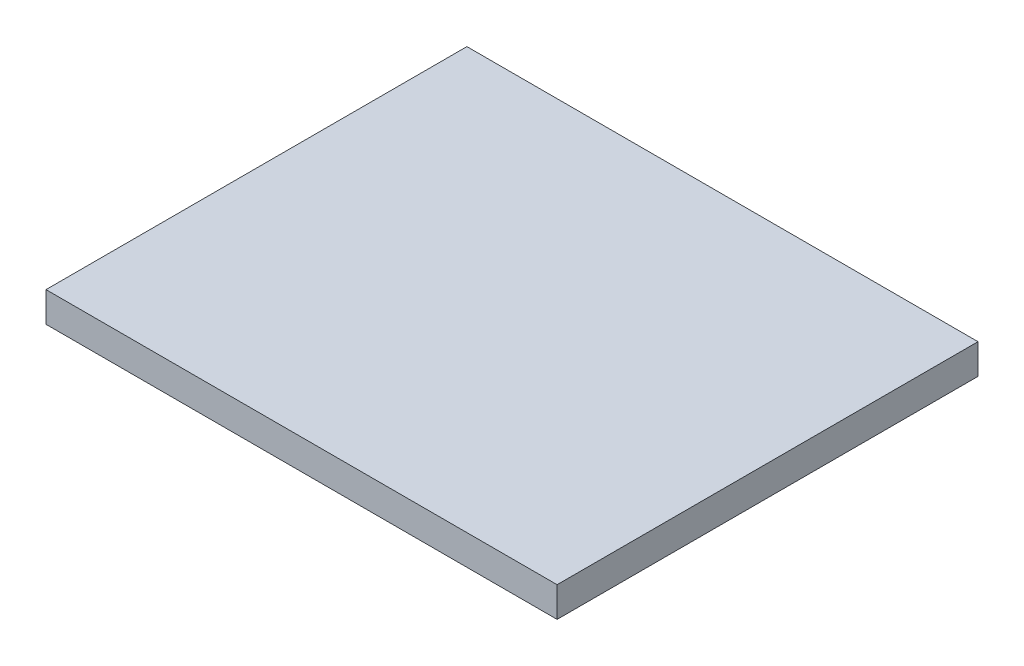
from build123d import *

# Parameters (mm, degrees)
SKETCH1_W           = 170
SKETCH1_H           = 140
BOSS_EXTRUDE1_DEPTH = 10


with BuildPart() as part:
    # Sketch1 → Boss-Extrude1 (new body)
    with BuildSketch(Plane(origin=(0, 0, 0), x_dir=(1, 0, 0), z_dir=(0, 1, 0))):
        Rectangle(SKETCH1_W, SKETCH1_H)
    extrude(amount=BOSS_EXTRUDE1_DEPTH)


solid = part.part
